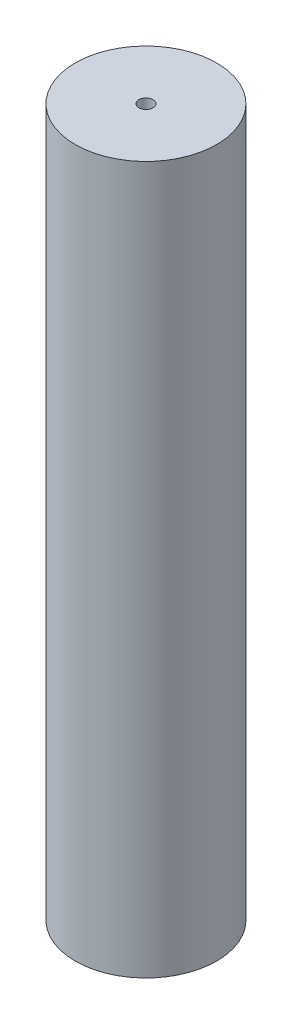
from build123d import *

# Parameters (mm, degrees)
SKETCH1_R           = 100
SKETCH1_R_2         = 10
BOSS_EXTRUDE1_DEPTH = 1000


with BuildPart() as part:
    # Sketch1 → Boss-Extrude1 (new body)
    with BuildSketch(Plane(origin=(0, 0, 0), x_dir=(1, 0, 0), z_dir=(0, 1, 0))):
        with Locations(Location((0, 0, 0), (0, 0, 270))):
            Circle(SKETCH1_R)
        with Locations(Location((0, 0, 0), (0, 0, 270))):
            Circle(SKETCH1_R_2, mode=Mode.SUBTRACT)
    extrude(amount=BOSS_EXTRUDE1_DEPTH)


solid = part.part
